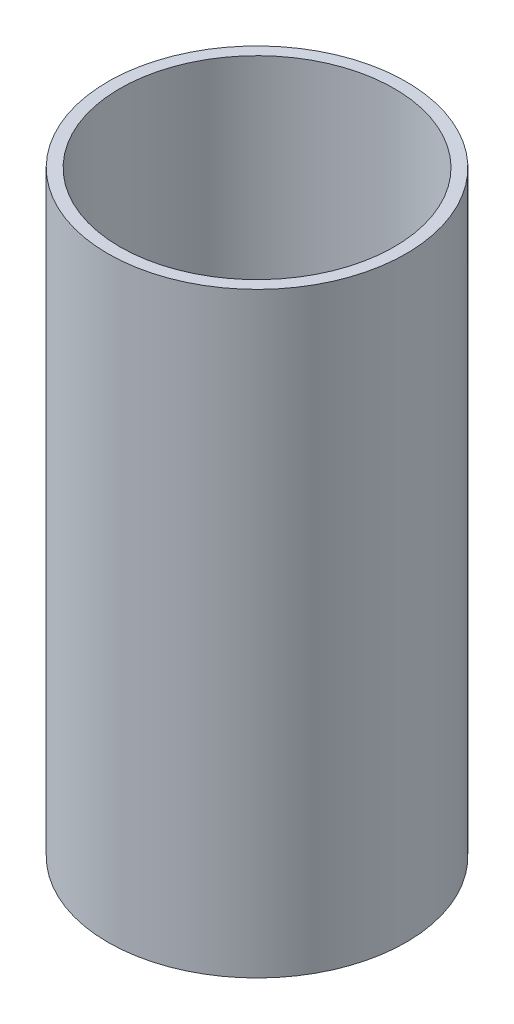
from build123d import *

# Parameters (mm, degrees)
SKETCH_1_W = 4
SKETCH_1_H = 200


with BuildPart() as part:
    # Эскиз1 → Повернуть-Тонкостенный1 (revolve)
    with BuildSketch(Plane.XY):
        with Locations((-48, 100)):
            Rectangle(SKETCH_1_W, SKETCH_1_H)
    revolve(axis=Axis((0, 26.168985987, 0), (0, -1, 0)))


solid = part.part
